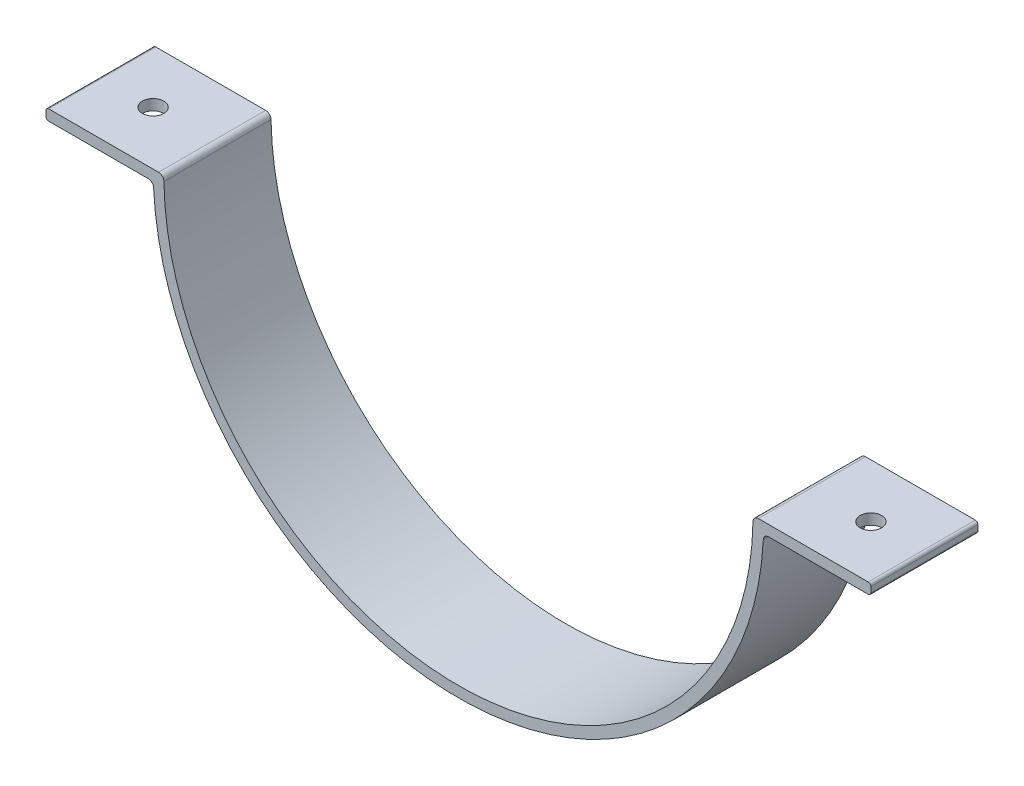
from build123d import *

# Parameters (mm, degrees)
SALIENTE_EXTRUIR2_DEPTH = 20
CROQUIS5_R              = 2
CORTAR_EXTRUIR2_DEPTH   = 98.867257037


with BuildPart() as part:
    # Croquis1 → Saliente-Extruir2 (new body)
    with BuildSketch(Plane.XY):
        with BuildLine():
            Line((-57, 0), (-55.991070717, 0))
            ThreePointArc((-55.991070717, 0), (-55.290305828, -0.286607702), (-54.991230168, -0.982142857))
            ThreePointArc((-54.991230168, -0.982142857), (0, -55), (54.991230168, -0.982142857))
            ThreePointArc((54.991230168, -0.982142857), (55.290305828, -0.286607702), (55.991070717, 0))
            Line((55.991070717, 0), (57, 0))
            Line((57, 0), (76.5, 0))
            ThreePointArc((76.5, 0), (76.853553391, -0.146446609), (77, -0.5))
            Line((77, -0.5), (77, -1.5))
            ThreePointArc((77, -1.5), (76.853553391, -1.853553391), (76.5, -2))
            Line((76.5, -2), (57.92236183, -2))
            ThreePointArc((57.92236183, -2), (57.233785087, -2.274836523), (56.923700419, -2.948275862))
            ThreePointArc((56.923700419, -2.948275862), (0, -57), (-56.923700419, -2.948275862))
            ThreePointArc((-56.923700419, -2.948275862), (-57.233785087, -2.274836523), (-57.92236183, -2))
            Line((-57.92236183, -2), (-76.5, -2))
            ThreePointArc((-76.5, -2), (-76.853553391, -1.853553391), (-77, -1.5))
            Line((-77, -1.5), (-77, -0.5))
            ThreePointArc((-77, -0.5), (-76.853553391, -0.146446609), (-76.5, 0))
            Line((-76.5, 0), (-57, 0))
        make_face()
    extrude(amount=SALIENTE_EXTRUIR2_DEPTH)

    # Croquis5 → Cortar-Extruir2 (cut, symmetric)
    with BuildSketch(Plane(origin=(0, 0, 0), x_dir=(1, 0, 0), z_dir=(0, 1, 0))):
        with Locations(Location((67, -10, 0), (0, 0, 270))):
            Circle(CROQUIS5_R)
    cortar_extruir2 = extrude(amount=CORTAR_EXTRUIR2_DEPTH, both=True, mode=Mode.SUBTRACT)

    # Simetría4: Cortar-Extruir2 across plane
    add(cortar_extruir2.mirror(Plane(origin=(0, 0, 0), x_dir=(0, 0, 1), z_dir=(1, 0, 0))), mode=Mode.SUBTRACT)


solid = part.part
